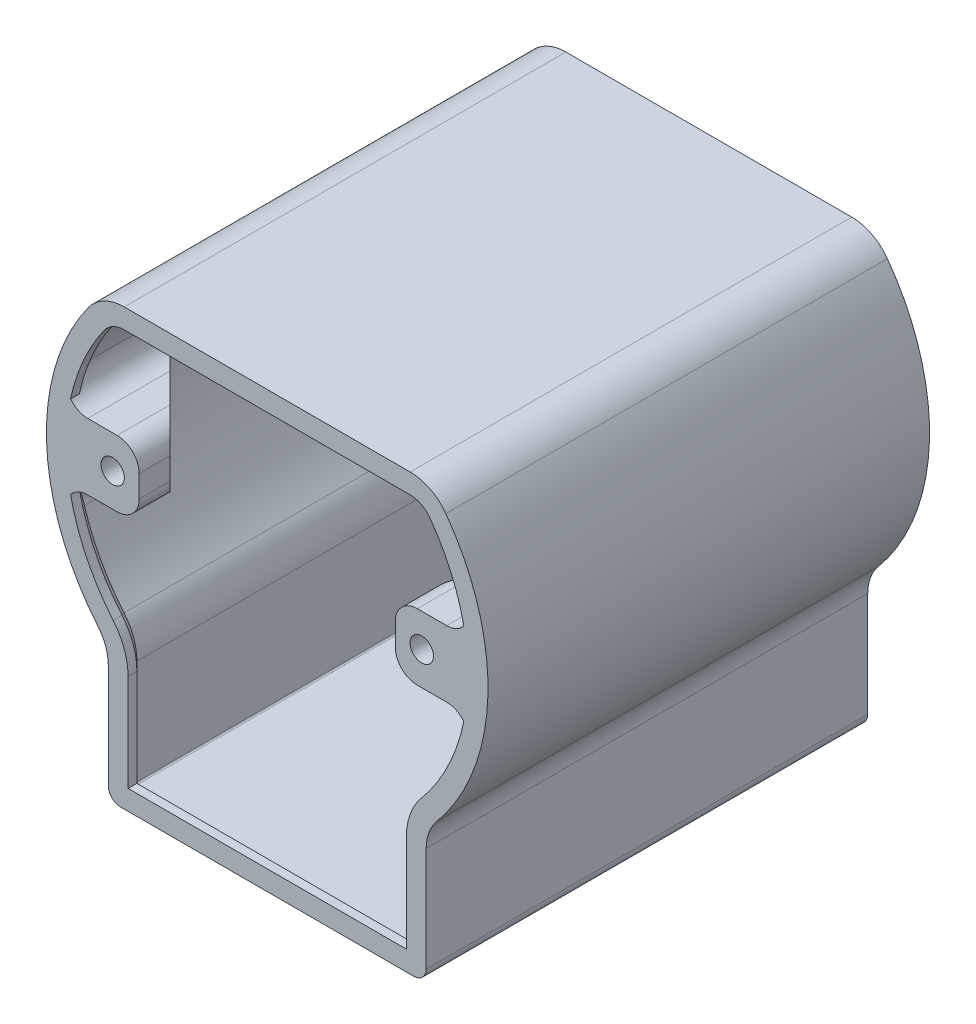
from build123d import *

# Parameters (mm, degrees)
LINEAR_AUSTRAGEN_D_NN1_DEPTH                = 100
AUFSATZ_LINEAR_AUSTRAGEN3_REACH             = 160.325
AUFSATZ_LINEAR_START                        = 29
SKIZZE6_W                                   = 25
SKIZZE6_H                                   = 15
FASE1_SIZE                                  = 18
SKIZZE7_R                                   = 2.65
SCHNITT_LINEAR_AUSTRAGEN3_DEPTH             = 130.325171564
SCHNITT_LINEAR_START                        = -5
SCHNITT_LINEAR_AUSTRAGEN5_DEPTH             = 90
VERRUNDUNG1_R                               = 5
AUFSATZ_LINEAR_AUSTRAGEN5_REACH             = 131.325
AUFSATZ_LINEAR_AUSTRAGEN5_DIRECTION_2_REACH = 131.325


with BuildPart() as part:
    # Skizze1 → Linear-Austragen-Dünn1 (new body)
    with BuildSketch(Plane.XY):
        with BuildLine():
            Line((-33.2, -65), (0, -65))
            Line((0, -65), (33.2, -65))
            ThreePointArc((33.2, -65), (35.179898987, -64.179898987), (36, -62.2))
            Line((36, -62.2), (36, -38.522720569))
            ThreePointArc((36, -38.522720569), (36.601418547, -35.107070313), (38.333333333, -32.10226714))
            ThreePointArc((38.333333333, -32.10226714), (49.970076451, -1.729583607), (40.461208274, 29.375))
            ThreePointArc((40.461208274, 29.375), (36.91044215, 32.409264841), (32.368966619, 33.5))
            Line((32.368966619, 33.5), (0, 33.5))
            Line((0, 33.5), (-32.368966619, 33.5))
            ThreePointArc((-32.368966619, 33.5), (-36.91044215, 32.409264841), (-40.461208274, 29.375))
            ThreePointArc((-40.461208274, 29.375), (-49.970076451, -1.729583607), (-38.333333333, -32.10226714))
            ThreePointArc((-38.333333333, -32.10226714), (-36.601418547, -35.107070313), (-36, -38.522720569))
            Line((-36, -38.522720569), (-36, -62.2))
            ThreePointArc((-36, -62.2), (-35.179898987, -64.179898987), (-33.2, -65))
        make_face()
        with BuildLine():
            Line((-33.2, -62.51), (0, -62.51))
            Line((0, -62.51), (33.2, -62.51))
            ThreePointArc((33.2, -62.51), (33.419203102, -62.419203102), (33.51, -62.2))
            Line((33.51, -62.2), (33.51, -38.522720569))
            ThreePointArc((33.51, -38.522720569), (34.261171765, -34.2565734), (36.424333333, -30.503574237))
            ThreePointArc((36.424333333, -30.503574237), (47.481566644, -1.643450344), (38.446240102, 27.912125))
            ThreePointArc((38.446240102, 27.912125), (35.779614743, 30.190857895), (32.368966619, 31.01))
            Line((32.368966619, 31.01), (0, 31.01))
            Line((0, 31.01), (-32.368966619, 31.01))
            ThreePointArc((-32.368966619, 31.01), (-35.779614743, 30.190857895), (-38.446240102, 27.912125))
            ThreePointArc((-38.446240102, 27.912125), (-47.481566644, -1.643450344), (-36.424333333, -30.503574237))
            ThreePointArc((-36.424333333, -30.503574237), (-34.261171765, -34.2565734), (-33.51, -38.522720569))
            Line((-33.51, -38.522720569), (-33.51, -62.2))
            ThreePointArc((-33.51, -62.2), (-33.419203102, -62.419203102), (-33.2, -62.51))
        make_face(mode=Mode.SUBTRACT)
    extrude(amount=LINEAR_AUSTRAGEN_D_NN1_DEPTH)

    # Austragung2: sweep along a path in Skizze16
    with BuildLine(Plane.XY.offset(100)) as austragung2_path:
        Line((33.51, -62.2), (33.51, -38.522720569))
        ThreePointArc((33.51, -38.522720569), (34.261171765, -34.2565734), (36.424333333, -30.503574237))
        ThreePointArc((36.424333333, -30.503574237), (47.481566644, -1.643450344), (38.446240102, 27.912125))
        ThreePointArc((38.446240102, 27.912125), (35.779614743, 30.190857895), (32.368966619, 31.01))
        Line((32.368966619, 31.01), (-32.368966619, 31.01))
        ThreePointArc((-32.368966619, 31.01), (-35.779614743, 30.190857895), (-38.446240102, 27.912125))
        ThreePointArc((-38.446240102, 27.912125), (-47.481566644, -1.643450344), (-36.424333333, -30.503574237))
        ThreePointArc((-36.424333333, -30.503574237), (-34.261171765, -34.2565734), (-33.51, -38.522720569))
        Line((-33.51, -38.522720569), (-33.51, -62.2))
    # Skizze17 → Austragung2 (sweep)
    with BuildSketch(Plane(origin=(0, 0, 0), x_dir=(0, 0, -1), z_dir=(1, 0, 0))):
        Polygon((-100, 31.01), (-100, 29.01), (-98, 29.01), (-96, 31.01), align=None)
    sweep(path=austragung2_path.line)

    # Skizze6 → Aufsatz-Linear austragen3 (add, up to next)
    with BuildSketch(Plane(origin=(0, 0, 0), x_dir=(0, 0, -1), z_dir=(1, 0, 0)).offset(AUFSATZ_LINEAR_START), mode=Mode.PRIVATE) as aufsatz_linear_austragen3_sk1:
        with Locations((-87.5, 0)):
            Rectangle(SKIZZE6_W, SKIZZE6_H)
    aufsatz_linear_austragen3_tool1 = extrude(aufsatz_linear_austragen3_sk1.sketch, amount=AUFSATZ_LINEAR_AUSTRAGEN3_REACH, mode=Mode.PRIVATE) - part.part
    # Skizze6 → Aufsatz-Linear austragen3 (add, up to next)
    with BuildSketch(Plane(origin=(0, 0, 0), x_dir=(0, 0, -1), z_dir=(1, 0, 0)).offset(AUFSATZ_LINEAR_START), mode=Mode.PRIVATE) as aufsatz_linear_austragen3_sk2:
        with Locations((-12.5, 0)):
            Rectangle(SKIZZE6_W, SKIZZE6_H)
    aufsatz_linear_austragen3_tool2 = extrude(aufsatz_linear_austragen3_sk2.sketch, amount=AUFSATZ_LINEAR_AUSTRAGEN3_REACH, mode=Mode.PRIVATE) - part.part
    aufsatz_linear_austragen3_1 = aufsatz_linear_austragen3_tool1.solids().sort_by_distance((29, 0, 87.5))[0]
    add(aufsatz_linear_austragen3_1)
    aufsatz_linear_austragen3_2 = aufsatz_linear_austragen3_tool2.solids().sort_by_distance((29, 0, 12.5))[0]
    add(aufsatz_linear_austragen3_2)
    aufsatz_linear_austragen3 = aufsatz_linear_austragen3_1 + aufsatz_linear_austragen3_2  # Aufsatz-Linear austragen3 as one shape, for the pattern or mirror that repeats it

    # Spiegeln1: Aufsatz-Linear austragen3 across plane
    add(aufsatz_linear_austragen3.mirror(Plane(origin=(0, 0, 0), x_dir=(0, 0, 1), z_dir=(1, 0, 0))))

    # Fase1
    fase1_edges = [part.edges().sort_by_distance(p)[0] for p in [
        (29, 0, 75),
        (-29, 0, 75),
        (29, 0, 25),
        (-29, 0, 25),
    ]]
    chamfer(fase1_edges, length=FASE1_SIZE)

    # Skizze7 → Schnitt-Linear austragen3 (cut, through all)
    with BuildSketch(Plane.XY.offset(100)):
        with Locations((-35, 0)):
            Circle(SKIZZE7_R)
        with Locations((35, 0)):
            Circle(SKIZZE7_R)
    extrude(amount=-SCHNITT_LINEAR_AUSTRAGEN3_DEPTH, mode=Mode.SUBTRACT)

    # Skizze9 → Schnitt-Linear austragen5 (cut)
    with BuildSketch(Plane.XY.offset(100).offset(SCHNITT_LINEAR_START)):
        Polygon((-39.618802154, 0), (-37.309401077, -4), (-32.690598923, -4), (-30.381197846, 0), (-32.690598923, 4), (-37.309401077, 4), align=None)
        Polygon((30.381197846, 0), (32.690598923, -4), (37.309401077, -4), (39.618802154, 0), (37.309401077, 4), (32.690598923, 4), align=None)
    extrude(amount=-SCHNITT_LINEAR_AUSTRAGEN5_DEPTH, mode=Mode.SUBTRACT)

    # Verrundung1
    verrundung1_edges = [part.edges().sort_by_distance(p)[0] for p in [
        (-46.914284605, 7.5, 85.542857697),
        (-29, 7.5, 96.5),
        (-29, -7.5, 96.5),
        (-46.914284605, -7.5, 85.542857697),
        (46.914284605, -7.5, 85.542857697),
        (29, -7.5, 96.5),
        (29, 7.5, 96.5),
        (46.914284605, 7.5, 85.542857697),
        (-46.914284605, -7.5, 12.457142303),
        (-29, -7.5, 3.5),
        (-29, 7.5, 3.5),
        (-46.914284605, 7.5, 12.457142303),
        (46.914284605, -7.5, 12.457142303),
        (29, -7.5, 3.5),
        (29, 7.5, 3.5),
        (46.914284605, 7.5, 12.457142303),
    ]]
    fillet(verrundung1_edges, radius=VERRUNDUNG1_R)

    # Skizze17<3> → Aufsatz-Linear austragen5 (add, up to next)
    with BuildSketch(Plane(origin=(0, 0, 0), x_dir=(0, 0, -1), z_dir=(1, 0, 0)), mode=Mode.PRIVATE) as aufsatz_linear_austragen5_sk1:
        Polygon((-98, -60.51), (-96, -62.51), (-100, -62.51), (-100, -60.51), align=None)
    aufsatz_linear_austragen5_tool1 = extrude(aufsatz_linear_austragen5_sk1.sketch, amount=-AUFSATZ_LINEAR_AUSTRAGEN5_REACH, mode=Mode.PRIVATE) - part.part
    add(aufsatz_linear_austragen5_tool1.solids().sort_by_distance((0, -61.621111, 98.444444))[0])

    # Skizze17<3> → Aufsatz-Linear austragen5 direction 2 (add, up to next)
    with BuildSketch(Plane(origin=(0, 0, 0), x_dir=(0, 0, -1), z_dir=(1, 0, 0)), mode=Mode.PRIVATE) as aufsatz_linear_austragen5_direction_2_sk1:
        Polygon((-98, -60.51), (-96, -62.51), (-100, -62.51), (-100, -60.51), align=None)
    aufsatz_linear_austragen5_direction_2_tool1 = extrude(aufsatz_linear_austragen5_direction_2_sk1.sketch, amount=AUFSATZ_LINEAR_AUSTRAGEN5_DIRECTION_2_REACH, mode=Mode.PRIVATE) - part.part
    add(aufsatz_linear_austragen5_direction_2_tool1.solids().sort_by_distance((0, -61.621111, 98.444444))[0])


solid = part.part
